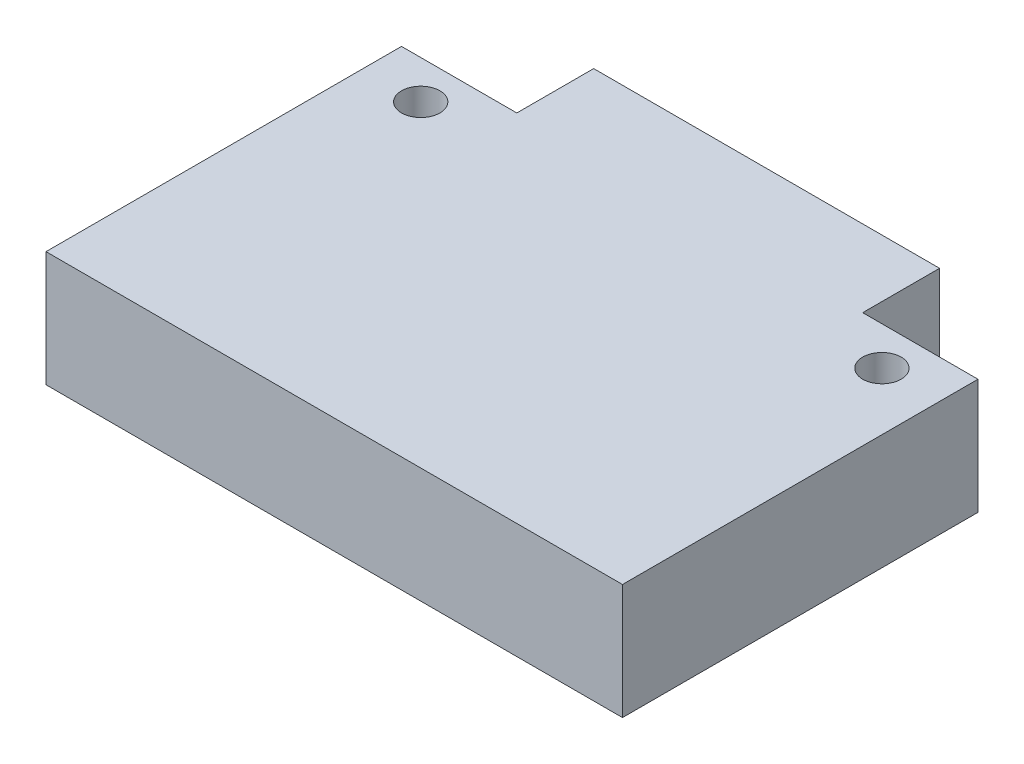
from build123d import *

# Parameters (mm, degrees)
BOSS_EXTRUDE1_DEPTH = 6
SKETCH2_R           = 1
CUT_EXTRUDE1_DEPTH  = 38.976966704


with BuildPart() as part:
    # Sketch1 → Boss-Extrude1 (new body)
    with BuildSketch(Plane(origin=(0, 0, 0), x_dir=(1, 0, 0), z_dir=(0, 1, 0))):
        Polygon((0, 18.5), (6, 18.5), (6, 22.5), (24, 22.5), (24, 18.5), (30, 18.5), (30, 0), (0, 0), align=None)
    extrude(amount=BOSS_EXTRUDE1_DEPTH)

    # Sketch2 → Cut-Extrude1 (cut, through all)
    with BuildSketch(Plane(origin=(0, 6, 0), x_dir=(1, 0, 0), z_dir=(0, 1, 0))):
        with Locations(Location((3, 16.5, 0), (0, 0, 270))):
            Circle(SKETCH2_R)
        with Locations(Location((27, 16.5, 0), (0, 0, 270))):
            Circle(SKETCH2_R)
    extrude(amount=-CUT_EXTRUDE1_DEPTH, mode=Mode.SUBTRACT)


solid = part.part
